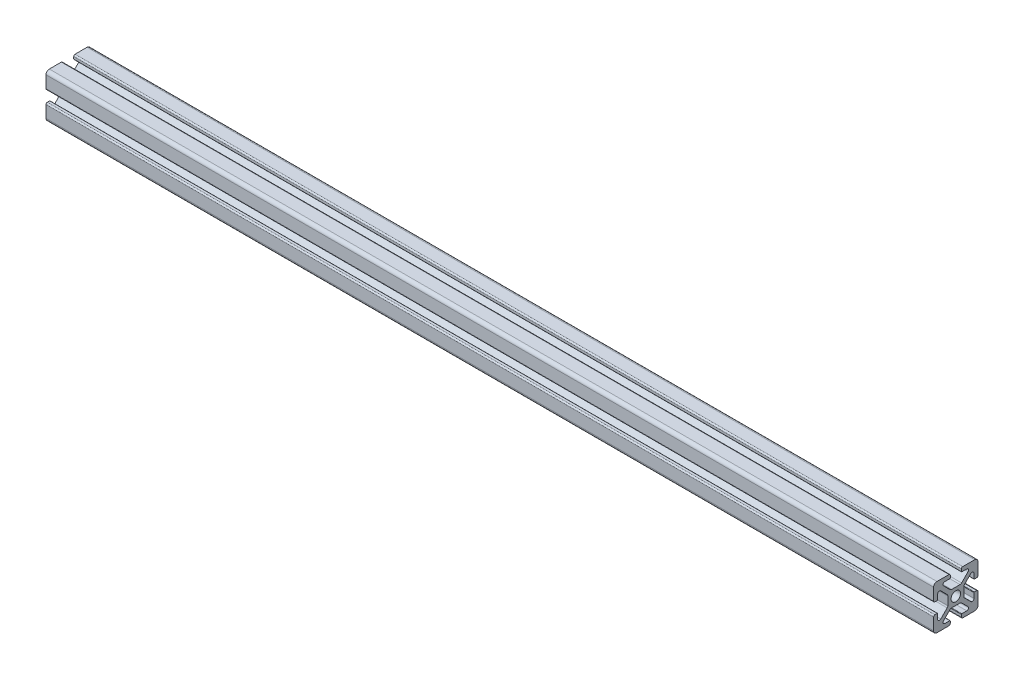
from build123d import *
from build123d.topology import SkipClean

# Parameters (mm, degrees)
BOSS_EXTRUDE1_DEPTH      = 152.4
BOSS_EXTRUDE1_DEPTH_BACK = 152.4
SKETCH4_R                = 2.15
BOSS_EXTRUDE2_DEPTH      = 95.2


with BuildPart() as part:
    # Sketch3 → Boss-Extrude1 (new, two sides: drawn at the far end of the back side and taken through both)
    with BuildSketch(Plane(origin=(0, 0, 0), x_dir=(0, 0, -1), z_dir=(1, 0, 0)).offset(-BOSS_EXTRUDE1_DEPTH_BACK)):
        with BuildLine():
            Line((-5.515685425, 6.807463915), (-2.601114729, 3.892893219))
            ThreePointArc((-2.601114729, 3.892893219), (-2.27669138, 3.676120467), (-1.894007948, 3.6))
            Line((-1.894007948, 3.6), (0, 3.6))
            Line((0, 3.6), (0, 2.15))
            ThreePointArc((0, 2.15), (-1.52027958, 1.52027958), (-2.15, 0))
            Line((-2.15, 0), (-3.6, 0))
            Line((-3.6, 0), (-3.6, 1.894007948))
            ThreePointArc((-3.6, 1.894007948), (-3.676120467, 2.27669138), (-3.892893219, 2.601114729))
            Line((-3.892893219, 2.601114729), (-6.807463915, 5.515685425))
            ThreePointArc((-6.807463915, 5.515685425), (-7.679296086, 5.689103626), (-8.17314934, 4.95))
            Line((-8.17314934, 4.95), (-8.17314934, 2.7))
            ThreePointArc((-8.17314934, 2.7), (-8.231727984, 2.558578644), (-8.37314934, 2.5))
            Line((-8.37314934, 2.5), (-9.4, 2.5))
            ThreePointArc((-9.4, 2.5), (-9.824264069, 2.675735931), (-10, 3.1))
            Line((-10, 3.1), (-10, 8.5))
            ThreePointArc((-10, 8.5), (-9.560660172, 9.560660172), (-8.5, 10))
            Line((-8.5, 10), (-3.1, 10))
            ThreePointArc((-3.1, 10), (-2.675735931, 9.824264069), (-2.5, 9.4))
            Line((-2.5, 9.4), (-2.5, 8.37314934))
            ThreePointArc((-2.5, 8.37314934), (-2.558578644, 8.231727984), (-2.7, 8.17314934))
            Line((-2.7, 8.17314934), (-4.95, 8.17314934))
            ThreePointArc((-4.95, 8.17314934), (-5.689103626, 7.679296086), (-5.515685425, 6.807463915))
        make_face()
    extrude(amount=BOSS_EXTRUDE1_DEPTH + BOSS_EXTRUDE1_DEPTH_BACK)

    # Mirror1: part across plane


with BuildPart() as part_1:
    add(part.part)
    add(part.part.mirror(Plane.ZX))

    # Mirror2: part across plane


with BuildPart() as part_2:
    add(part_1.part)
    add(part_1.part.mirror(Plane.XY))

    # Sketch4 → Boss-Extrude2 (add)
    with SkipClean():  # the faces are left unmerged after this step: merging them gives an invalid solid
        with BuildSketch(Plane(origin=(152.4, 0, 0), x_dir=(0, 0, -1), z_dir=(1, 0, 0))):
            with BuildLine():
                Line((1.894007948, 3.6), (-1.894007948, 3.6))
                ThreePointArc((-1.894007948, 3.6), (-2.27669138, 3.676120467), (-2.601114729, 3.892893219))
                Line((-2.601114729, 3.892893219), (-5.515685425, 6.807463915))
                ThreePointArc((-5.515685425, 6.807463915), (-5.689103626, 7.679296086), (-4.95, 8.17314934))
                Line((-4.95, 8.17314934), (-2.7, 8.17314934))
                ThreePointArc((-2.7, 8.17314934), (-2.558578644, 8.231727984), (-2.5, 8.37314934))
                Line((-2.5, 8.37314934), (-2.5, 9.4))
                ThreePointArc((-2.5, 9.4), (-2.675735931, 9.824264069), (-3.1, 10))
                Line((-3.1, 10), (-8.5, 10))
                ThreePointArc((-8.5, 10), (-9.560660172, 9.560660172), (-10, 8.5))
                Line((-10, 8.5), (-10, 3.1))
                ThreePointArc((-10, 3.1), (-9.824264069, 2.675735931), (-9.4, 2.5))
                Line((-9.4, 2.5), (-8.37314934, 2.5))
                ThreePointArc((-8.37314934, 2.5), (-8.231727984, 2.558578644), (-8.17314934, 2.7))
                Line((-8.17314934, 2.7), (-8.17314934, 4.95))
                ThreePointArc((-8.17314934, 4.95), (-7.679296086, 5.689103626), (-6.807463915, 5.515685425))
                Line((-6.807463915, 5.515685425), (-3.892893219, 2.601114729))
                ThreePointArc((-3.892893219, 2.601114729), (-3.676120467, 2.27669138), (-3.6, 1.894007948))
                Line((-3.6, 1.894007948), (-3.6, -1.894007948))
                ThreePointArc((-3.6, -1.894007948), (-3.676120467, -2.27669138), (-3.892893219, -2.601114729))
                Line((-3.892893219, -2.601114729), (-6.807463915, -5.515685425))
                ThreePointArc((-6.807463915, -5.515685425), (-7.679296086, -5.689103626), (-8.17314934, -4.95))
                Line((-8.17314934, -4.95), (-8.17314934, -2.7))
                ThreePointArc((-8.17314934, -2.7), (-8.231727984, -2.558578644), (-8.37314934, -2.5))
                Line((-8.37314934, -2.5), (-9.4, -2.5))
                ThreePointArc((-9.4, -2.5), (-9.824264069, -2.675735931), (-10, -3.1))
                Line((-10, -3.1), (-10, -8.5))
                ThreePointArc((-10, -8.5), (-9.560660172, -9.560660172), (-8.5, -10))
                Line((-8.5, -10), (-3.1, -10))
                ThreePointArc((-3.1, -10), (-2.675735931, -9.824264069), (-2.5, -9.4))
                Line((-2.5, -9.4), (-2.5, -8.37314934))
                ThreePointArc((-2.5, -8.37314934), (-2.558578644, -8.231727984), (-2.7, -8.17314934))
                Line((-2.7, -8.17314934), (-4.95, -8.17314934))
                ThreePointArc((-4.95, -8.17314934), (-5.689103626, -7.679296086), (-5.515685425, -6.807463915))
                Line((-5.515685425, -6.807463915), (-2.601114729, -3.892893219))
                ThreePointArc((-2.601114729, -3.892893219), (-2.27669138, -3.676120467), (-1.894007948, -3.6))
                Line((-1.894007948, -3.6), (1.894007948, -3.6))
                ThreePointArc((1.894007948, -3.6), (2.27669138, -3.676120467), (2.601114729, -3.892893219))
                Line((2.601114729, -3.892893219), (5.515685425, -6.807463915))
                ThreePointArc((5.515685425, -6.807463915), (5.689103626, -7.679296086), (4.95, -8.17314934))
                Line((4.95, -8.17314934), (2.7, -8.17314934))
                ThreePointArc((2.7, -8.17314934), (2.558578644, -8.231727984), (2.5, -8.37314934))
                Line((2.5, -8.37314934), (2.5, -9.4))
                ThreePointArc((2.5, -9.4), (2.675735931, -9.824264069), (3.1, -10))
                Line((3.1, -10), (8.5, -10))
                ThreePointArc((8.5, -10), (9.560660172, -9.560660172), (10, -8.5))
                Line((10, -8.5), (10, -3.1))
                ThreePointArc((10, -3.1), (9.824264069, -2.675735931), (9.4, -2.5))
                Line((9.4, -2.5), (8.37314934, -2.5))
                ThreePointArc((8.37314934, -2.5), (8.231727984, -2.558578644), (8.17314934, -2.7))
                Line((8.17314934, -2.7), (8.17314934, -4.95))
                ThreePointArc((8.17314934, -4.95), (7.679296086, -5.689103626), (6.807463915, -5.515685425))
                Line((6.807463915, -5.515685425), (3.892893219, -2.601114729))
                ThreePointArc((3.892893219, -2.601114729), (3.676120467, -2.27669138), (3.6, -1.894007948))
                Line((3.6, -1.894007948), (3.6, 1.894007948))
                ThreePointArc((3.6, 1.894007948), (3.676120467, 2.27669138), (3.892893219, 2.601114729))
                Line((3.892893219, 2.601114729), (6.807463915, 5.515685425))
                ThreePointArc((6.807463915, 5.515685425), (7.679296086, 5.689103626), (8.17314934, 4.95))
                Line((8.17314934, 4.95), (8.17314934, 2.7))
                ThreePointArc((8.17314934, 2.7), (8.231727984, 2.558578644), (8.37314934, 2.5))
                Line((8.37314934, 2.5), (9.4, 2.5))
                ThreePointArc((9.4, 2.5), (9.824264069, 2.675735931), (10, 3.1))
                Line((10, 3.1), (10, 8.5))
                ThreePointArc((10, 8.5), (9.560660172, 9.560660172), (8.5, 10))
                Line((8.5, 10), (3.1, 10))
                ThreePointArc((3.1, 10), (2.675735931, 9.824264069), (2.5, 9.4))
                Line((2.5, 9.4), (2.5, 8.37314934))
                ThreePointArc((2.5, 8.37314934), (2.558578644, 8.231727984), (2.7, 8.17314934))
                Line((2.7, 8.17314934), (4.95, 8.17314934))
                ThreePointArc((4.95, 8.17314934), (5.689103626, 7.679296086), (5.515685425, 6.807463915))
                Line((5.515685425, 6.807463915), (2.601114729, 3.892893219))
                ThreePointArc((2.601114729, 3.892893219), (2.27669138, 3.676120467), (1.894007948, 3.6))
            make_face()
            Circle(SKETCH4_R, mode=Mode.SUBTRACT)
        extrude(amount=BOSS_EXTRUDE2_DEPTH)


solid = part_2.part
